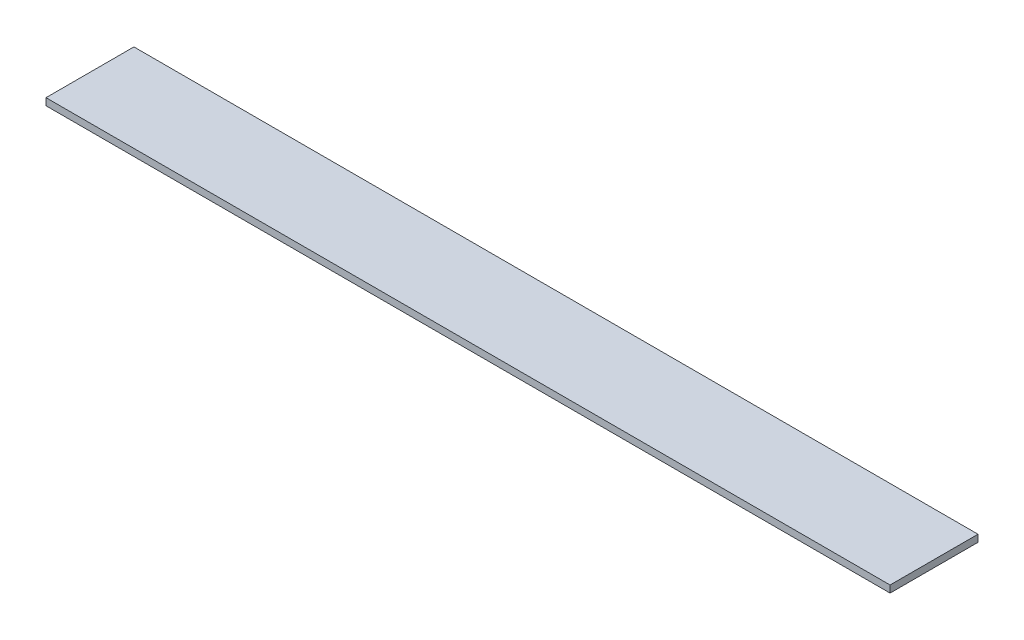
from build123d import *

# Parameters (mm, degrees)
SKETCH1_W           = 304.8
SKETCH1_H           = 31.75
BOSS_EXTRUDE1_DEPTH = 2.54


with BuildPart() as part:
    # Sketch1 → Boss-Extrude1 (new body)
    with BuildSketch(Plane(origin=(0, 0, 0), x_dir=(1, 0, 0), z_dir=(0, 1, 0))):
        with Locations((152.4, 15.875)):
            Rectangle(SKETCH1_W, SKETCH1_H)
    extrude(amount=BOSS_EXTRUDE1_DEPTH)


solid = part.part
